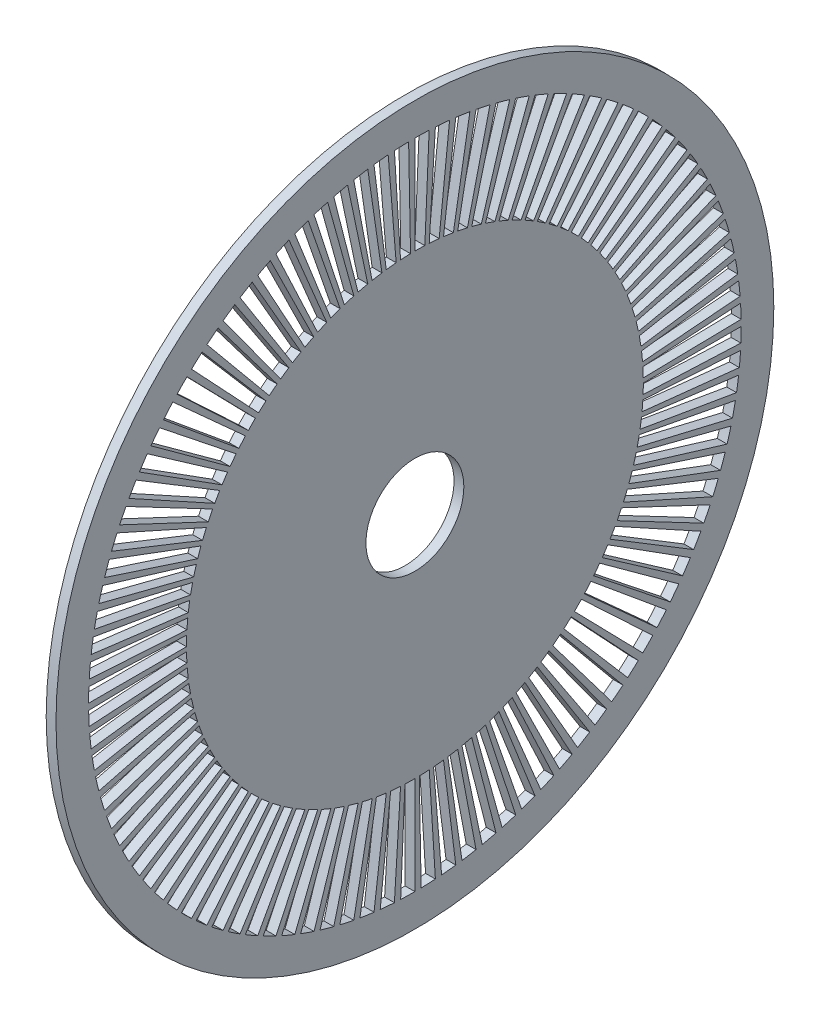
from build123d import *

# Parameters (mm, degrees)
ESQUISSE1_R        = 11
ESQUISSE1_R_2      = 1.5
BOSS_EXTRU_1_DEPTH = 0.3


with BuildPart() as part:
    # Esquisse1 → Boss.-Extru.1 (new body)
    with BuildSketch(Plane(origin=(0, 0, 0), x_dir=(0, 0, -1), z_dir=(1, 0, 0))):
        Circle(ESQUISSE1_R)
        Circle(ESQUISSE1_R_2, mode=Mode.SUBTRACT)
        with BuildLine():
            Line((0, 7), (0, 10))
            ThreePointArc((0, 10), (0.21814885, 9.997620271), (0.436193874, 9.990482216))
            Line((0.436193874, 9.990482216), (0.305335712, 6.993337551))
            ThreePointArc((0.305335712, 6.993337551), (0.152704195, 6.99833419), (0, 7))
        make_face(mode=Mode.SUBTRACT)
        with BuildLine():
            Line((0.743848499, 6.960365609), (1.062640713, 9.943379441))
            ThreePointArc((1.062640713, 9.943379441), (0.845474154, 9.964194571), (0.627905195, 9.980267284))
            Line((0.627905195, 9.980267284), (0.439533637, 6.986187099))
            ThreePointArc((0.439533637, 6.986187099), (0.591831908, 6.9749362), (0.743848499, 6.960365609))
        make_face(mode=Mode.SUBTRACT)
        with BuildLine():
            Line((1.179425657, 6.899924284), (1.684893796, 9.857034691))
            ThreePointArc((1.684893796, 9.857034691), (1.469462758, 9.891444748), (1.253332336, 9.921147013))
            Line((1.253332336, 9.921147013), (0.877332635, 6.944802909))
            ThreePointArc((0.877332635, 6.944802909), (1.028623931, 6.924011324), (1.179425657, 6.899924284))
        make_face(mode=Mode.SUBTRACT)
        with BuildLine():
            Line((1.61034816, 6.812252109), (2.300497372, 9.731788728))
            ThreePointArc((2.300497372, 9.731788728), (2.087652064, 9.779657911), (1.873813146, 9.822872507))
            Line((1.873813146, 9.822872507), (1.311669202, 6.876010755))
            ThreePointArc((1.311669202, 6.876010755), (1.461356444, 6.845760538), (1.61034816, 6.812252109))
        make_face(mode=Mode.SUBTRACT)
        with BuildLine():
            Line((2.034915355, 6.697695088), (2.907021936, 9.568135841))
            ThreePointArc((2.907021936, 9.568135841), (2.69760236, 9.629275233), (2.486898872, 9.685831611))
            Line((2.486898872, 9.685831611), (1.74082921, 6.780082128))
            ThreePointArc((1.74082921, 6.780082128), (1.888321652, 6.740492663), (2.034915355, 6.697695088))
        make_face(mode=Mode.SUBTRACT)
        with BuildLine():
            Line((2.451451669, 6.556705325), (3.502073813, 9.366721892))
            ThreePointArc((3.502073813, 9.366721892), (3.296906453, 9.440890204), (3.090169944, 9.510565163))
            Line((3.090169944, 9.510565163), (2.163118961, 6.657395614))
            ThreePointArc((2.163118961, 6.657395614), (2.307834517, 6.608623143), (2.451451669, 6.556705325))
        make_face(mode=Mode.SUBTRACT)
        with BuildLine():
            Line((2.858313223, 6.389839241), (4.083304604, 9.128341772))
            ThreePointArc((4.083304604, 9.128341772), (3.883199162, 9.215246295), (3.681245527, 9.297764859))
            Line((3.681245527, 9.297764859), (2.576871869, 6.508435401))
            ThreePointArc((2.576871869, 6.508435401), (2.718239413, 6.450672406), (2.858313223, 6.389839241))
        make_face(mode=Mode.SUBTRACT)
        with BuildLine():
            Line((3.25389432, 6.19775538), (4.648420457, 8.853936258))
            ThreePointArc((4.648420457, 8.853936258), (4.454166657, 8.953234018), (4.257792916, 9.048270525))
            Line((4.257792916, 9.048270525), (2.980455041, 6.333789367))
            ThreePointArc((2.980455041, 6.333789367), (3.11791666, 6.267263813), (3.25389432, 6.19775538))
        make_face(mode=Mode.SUBTRACT)
        with BuildLine():
            Line((3.636633783, 5.981211811), (5.195191119, 8.544588301))
            ThreePointArc((5.195191119, 8.544588301), (5.007555593, 8.655887418), (4.817536741, 8.7630668))
            Line((4.817536741, 8.7630668), (3.372275719, 6.13414676))
            ThreePointArc((3.372275719, 6.13414676), (3.505288915, 6.059121192), (3.636633783, 5.981211811))
        make_face(mode=Mode.SUBTRACT)
        with BuildLine():
            Line((4.005021114, 5.741063131), (5.721458734, 8.201518759))
            ThreePointArc((5.721458734, 8.201518759), (5.541181993, 8.324379984), (5.35826795, 8.443279255))
            Line((5.35826795, 8.443279255), (3.750787565, 5.910295479))
            ThreePointArc((3.750787565, 5.910295479), (3.878827395, 5.827065989), (4.005021114, 5.741063131))
        make_face(mode=Mode.SUBTRACT)
        with BuildLine():
            Line((4.357602456, 5.478257098), (6.225146366, 7.826081569))
            ThreePointArc((6.225146366, 7.826081569), (6.05293988, 7.960020025), (5.877852523, 8.090169944))
            Line((5.877852523, 8.090169944), (4.114496766, 5.663118961))
            ThreePointArc((4.114496766, 5.663118961), (4.237057916, 5.572014018), (4.357602456, 5.478257098))
        make_face(mode=Mode.SUBTRACT)
        with BuildLine():
            Line((4.692986333, 5.193830887), (6.70426619, 7.41975841))
            ThreePointArc((6.70426619, 7.41975841), (6.540809579, 7.564245504), (6.374239897, 7.705132428))
            Line((6.374239897, 7.705132428), (4.461967928, 5.393592699))
            ThreePointArc((4.461967928, 5.393592699), (4.578566705, 5.294971853), (4.692986333, 5.193830887))
        make_face(mode=Mode.SUBTRACT)
        with BuildLine():
            Line((5.009849136, 4.888906998), (7.156927337, 6.984152854))
            ThreePointArc((7.156927337, 6.984152854), (7.002865691, 7.138618362), (6.845471059, 7.289686274))
            Line((6.845471059, 7.289686274), (4.791829742, 5.102780392))
            ThreePointArc((4.791829742, 5.102780392), (4.902005983, 4.997032853), (5.009849136, 4.888906998))
        make_face(mode=Mode.SUBTRACT)
        with BuildLine():
            Line((5.306940353, 4.564688827), (7.581343362, 6.520984038))
            ThreePointArc((7.581343362, 6.520984038), (7.43728469, 6.684818355), (7.289686274, 6.845471059))
            Line((7.289686274, 6.845471059), (5.102780392, 4.791829742))
            ThreePointArc((5.102780392, 4.791829742), (5.206099283, 4.679372848), (5.306940353, 4.564688827))
        make_face(mode=Mode.SUBTRACT)
        with BuildLine():
            Line((5.583087502, 4.222455914), (7.975839288, 6.032079877))
            ThreePointArc((7.975839288, 6.032079877), (7.842352125, 6.204636423), (7.705132428, 6.374239897))
            Line((7.705132428, 6.374239897), (5.393592699, 4.461967928))
            ThreePointArc((5.393592699, 4.461967928), (5.489646488, 4.343245496), (5.583087502, 4.222455914))
        make_face(mode=Mode.SUBTRACT)
        with BuildLine():
            Line((5.837200754, 3.863558897), (8.338858221, 5.519369853))
            ThreePointArc((8.338858221, 5.519369853), (8.216469379, 5.699967626), (8.090169944, 5.877852523))
            Line((8.090169944, 5.877852523), (5.663118961, 4.114496766))
            ThreePointArc((5.663118961, 4.114496766), (5.751528566, 3.989977338), (5.837200754, 3.863558897))
        make_face(mode=Mode.SUBTRACT)
        with BuildLine():
            Line((6.068277243, 3.489414178), (8.668967489, 4.984877398))
            ThreePointArc((8.668967489, 4.984877398), (8.558159983, 5.172803661), (8.443279255, 5.35826795))
            Line((8.443279255, 5.35826795), (5.910295479, 3.750787565))
            ThreePointArc((5.910295479, 3.750787565), (5.990711988, 3.620962563), (6.068277243, 3.489414178))
        make_face(mode=Mode.SUBTRACT)
        with BuildLine():
            Line((6.275405013, 3.101498336), (8.964864304, 4.430711908))
            ThreePointArc((8.964864304, 4.430711908), (8.866075438, 4.625225003), (8.7630668, 4.817536741))
            Line((8.7630668, 4.817536741), (6.13414676, 3.372275719))
            ThreePointArc((6.13414676, 3.372275719), (6.206252807, 3.237657502), (6.275405013, 3.101498336))
        make_face(mode=Mode.SUBTRACT)
        with BuildLine():
            Line((6.457766626, 2.701342296), (9.225380895, 3.859060423))
            ThreePointArc((9.225380895, 3.859060423), (9.139000544, 4.059392695), (9.048270525, 4.257792916))
            Line((9.048270525, 4.257792916), (6.333789367, 2.980455041))
            ThreePointArc((6.333789367, 2.980455041), (6.397300381, 2.841574886), (6.457766626, 2.701342296))
        make_face(mode=Mode.SUBTRACT)
        with BuildLine():
            Line((6.614642385, 2.290525293), (9.449489122, 3.27217899))
            ThreePointArc((9.449489122, 3.27217899), (9.375858191, 3.477539819), (9.297764859, 3.681245527))
            Line((9.297764859, 3.681245527), (6.508435401, 2.576871869))
            ThreePointArc((6.508435401, 2.576871869), (6.563100733, 2.434277873), (6.614642385, 2.290525293))
        make_face(mode=Mode.SUBTRACT)
        with BuildLine():
            Line((6.745413172, 1.870668633), (9.636304532, 2.672383761))
            ThreePointArc((9.636304532, 2.672383761), (9.575713608, 2.881962681), (9.510565163, 3.090169944))
            Line((9.510565163, 3.090169944), (6.657395614, 2.163118961))
            ThreePointArc((6.657395614, 2.163118961), (6.702999526, 2.017373877), (6.745413172, 1.870668633))
        make_face(mode=Mode.SUBTRACT)
        with BuildLine():
            Line((6.849562896, 1.443429298), (9.785089851, 2.062041854))
            ThreePointArc((9.785089851, 2.062041854), (9.737778059, 2.275011754), (9.685831611, 2.486898872))
            Line((9.685831611, 2.486898872), (6.780082128, 1.74082921))
            ThreePointArc((6.780082128, 1.74082921), (6.816444641, 1.592508228), (6.849562896, 1.443429298))
        make_face(mode=Mode.SUBTRACT)
        with BuildLine():
            Line((6.926680523, 1.010493407), (9.895257891, 1.44356201))
            ThreePointArc((9.895257891, 1.44356201), (9.861411948, 1.659082395), (9.822872507, 1.873813146))
            Line((9.822872507, 1.873813146), (6.876010755, 1.311669202))
            ThreePointArc((6.876010755, 1.311669202), (6.902988364, 1.161357676), (6.926680523, 1.010493407))
        make_face(mode=Mode.SUBTRACT)
        with BuildLine():
            Line((6.976461708, 0.57356956), (9.966373868, 0.819385086))
            ThreePointArc((9.966373868, 0.819385086), (9.94612735, 1.036605395), (9.921147013, 1.253332336))
            Line((9.921147013, 1.253332336), (6.944802909, 0.877332635))
            ThreePointArc((6.944802909, 0.877332635), (6.962289145, 0.725623776), (6.976461708, 0.57356956))
        make_face(mode=Mode.SUBTRACT)
        with BuildLine():
            Line((6.998709985, 0.134382097), (9.998157121, 0.191974424))
            ThreePointArc((9.998157121, 0.191974424), (9.991589931, 0.410037387), (9.980267284, 0.627905195))
            Line((9.980267284, 0.627905195), (6.986187099, 0.439533637))
            ThreePointArc((6.986187099, 0.439533637), (6.994112951, 0.287026171), (6.998709985, 0.134382097))
        make_face(mode=Mode.SUBTRACT)
        with BuildLine():
            Line((6.993337551, -0.305335712), (9.990482216, -0.436193874))
            ThreePointArc((9.990482216, -0.436193874), (9.997620271, -0.21814885), (10, 0))
            Line((10, 0), (7, 0))
            ThreePointArc((7, 0), (6.99833419, -0.152704195), (6.993337551, -0.305335712))
        make_face(mode=Mode.SUBTRACT)
        with BuildLine():
            Line((6.960365609, -0.743848499), (9.943379441, -1.062640713))
            ThreePointArc((9.943379441, -1.062640713), (9.964194571, -0.845474154), (9.980267284, -0.627905195))
            Line((9.980267284, -0.627905195), (6.986187099, -0.439533637))
            ThreePointArc((6.986187099, -0.439533637), (6.9749362, -0.591831908), (6.960365609, -0.743848499))
        make_face(mode=Mode.SUBTRACT)
        with BuildLine():
            Line((6.899924284, -1.179425657), (9.857034691, -1.684893796))
            ThreePointArc((9.857034691, -1.684893796), (9.891444748, -1.469462758), (9.921147013, -1.253332336))
            Line((9.921147013, -1.253332336), (6.944802909, -0.877332635))
            ThreePointArc((6.944802909, -0.877332635), (6.924011324, -1.028623931), (6.899924284, -1.179425657))
        make_face(mode=Mode.SUBTRACT)
        with BuildLine():
            Line((6.812252109, -1.61034816), (9.731788728, -2.300497372))
            ThreePointArc((9.731788728, -2.300497372), (9.779657911, -2.087652064), (9.822872507, -1.873813146))
            Line((9.822872507, -1.873813146), (6.876010755, -1.311669202))
            ThreePointArc((6.876010755, -1.311669202), (6.845760538, -1.461356444), (6.812252109, -1.61034816))
        make_face(mode=Mode.SUBTRACT)
        with BuildLine():
            Line((6.697695088, -2.034915355), (9.568135841, -2.907021936))
            ThreePointArc((9.568135841, -2.907021936), (9.629275233, -2.69760236), (9.685831611, -2.486898872))
            Line((9.685831611, -2.486898872), (6.780082128, -1.74082921))
            ThreePointArc((6.780082128, -1.74082921), (6.740492663, -1.888321652), (6.697695088, -2.034915355))
        make_face(mode=Mode.SUBTRACT)
        with BuildLine():
            Line((6.556705325, -2.451451669), (9.366721892, -3.502073813))
            ThreePointArc((9.366721892, -3.502073813), (9.440890204, -3.296906453), (9.510565163, -3.090169944))
            Line((9.510565163, -3.090169944), (6.657395614, -2.163118961))
            ThreePointArc((6.657395614, -2.163118961), (6.608623143, -2.307834517), (6.556705325, -2.451451669))
        make_face(mode=Mode.SUBTRACT)
        with BuildLine():
            Line((6.389839241, -2.858313223), (9.128341772, -4.083304604))
            ThreePointArc((9.128341772, -4.083304604), (9.215246295, -3.883199162), (9.297764859, -3.681245527))
            Line((9.297764859, -3.681245527), (6.508435401, -2.576871869))
            ThreePointArc((6.508435401, -2.576871869), (6.450672406, -2.718239413), (6.389839241, -2.858313223))
        make_face(mode=Mode.SUBTRACT)
        with BuildLine():
            Line((6.19775538, -3.25389432), (8.853936258, -4.648420457))
            ThreePointArc((8.853936258, -4.648420457), (8.953234018, -4.454166657), (9.048270525, -4.257792916))
            Line((9.048270525, -4.257792916), (6.333789367, -2.980455041))
            ThreePointArc((6.333789367, -2.980455041), (6.267263813, -3.11791666), (6.19775538, -3.25389432))
        make_face(mode=Mode.SUBTRACT)
        with BuildLine():
            Line((5.981211811, -3.636633783), (8.544588301, -5.195191119))
            ThreePointArc((8.544588301, -5.195191119), (8.655887418, -5.007555593), (8.7630668, -4.817536741))
            Line((8.7630668, -4.817536741), (6.13414676, -3.372275719))
            ThreePointArc((6.13414676, -3.372275719), (6.059121192, -3.505288915), (5.981211811, -3.636633783))
        make_face(mode=Mode.SUBTRACT)
        with BuildLine():
            Line((5.741063131, -4.005021114), (8.201518759, -5.721458734))
            ThreePointArc((8.201518759, -5.721458734), (8.324379984, -5.541181993), (8.443279255, -5.35826795))
            Line((8.443279255, -5.35826795), (5.910295479, -3.750787565))
            ThreePointArc((5.910295479, -3.750787565), (5.827065989, -3.878827395), (5.741063131, -4.005021114))
        make_face(mode=Mode.SUBTRACT)
        with BuildLine():
            Line((5.478257098, -4.357602456), (7.826081569, -6.225146366))
            ThreePointArc((7.826081569, -6.225146366), (7.960020025, -6.05293988), (8.090169944, -5.877852523))
            Line((8.090169944, -5.877852523), (5.663118961, -4.114496766))
            ThreePointArc((5.663118961, -4.114496766), (5.572014018, -4.237057916), (5.478257098, -4.357602456))
        make_face(mode=Mode.SUBTRACT)
        with BuildLine():
            Line((5.193830887, -4.692986333), (7.41975841, -6.70426619))
            ThreePointArc((7.41975841, -6.70426619), (7.564245504, -6.540809579), (7.705132428, -6.374239897))
            Line((7.705132428, -6.374239897), (5.393592699, -4.461967928))
            ThreePointArc((5.393592699, -4.461967928), (5.294971853, -4.578566705), (5.193830887, -4.692986333))
        make_face(mode=Mode.SUBTRACT)
        with BuildLine():
            Line((4.888906998, -5.009849136), (6.984152854, -7.156927337))
            ThreePointArc((6.984152854, -7.156927337), (7.138618362, -7.002865691), (7.289686274, -6.845471059))
            Line((7.289686274, -6.845471059), (5.102780392, -4.791829742))
            ThreePointArc((5.102780392, -4.791829742), (4.997032853, -4.902005983), (4.888906998, -5.009849136))
        make_face(mode=Mode.SUBTRACT)
        with BuildLine():
            Line((4.564688827, -5.306940353), (6.520984038, -7.581343362))
            ThreePointArc((6.520984038, -7.581343362), (6.684818355, -7.43728469), (6.845471059, -7.289686274))
            Line((6.845471059, -7.289686274), (4.791829742, -5.102780392))
            ThreePointArc((4.791829742, -5.102780392), (4.679372848, -5.206099283), (4.564688827, -5.306940353))
        make_face(mode=Mode.SUBTRACT)
        with BuildLine():
            Line((4.222455914, -5.583087502), (6.032079877, -7.975839288))
            ThreePointArc((6.032079877, -7.975839288), (6.204636423, -7.842352125), (6.374239897, -7.705132428))
            Line((6.374239897, -7.705132428), (4.461967928, -5.393592699))
            ThreePointArc((4.461967928, -5.393592699), (4.343245496, -5.489646488), (4.222455914, -5.583087502))
        make_face(mode=Mode.SUBTRACT)
        with BuildLine():
            Line((3.863558897, -5.837200754), (5.519369853, -8.338858221))
            ThreePointArc((5.519369853, -8.338858221), (5.699967626, -8.216469379), (5.877852523, -8.090169944))
            Line((5.877852523, -8.090169944), (4.114496766, -5.663118961))
            ThreePointArc((4.114496766, -5.663118961), (3.989977338, -5.751528566), (3.863558897, -5.837200754))
        make_face(mode=Mode.SUBTRACT)
        with BuildLine():
            Line((3.489414178, -6.068277243), (4.984877398, -8.668967489))
            ThreePointArc((4.984877398, -8.668967489), (5.172803661, -8.558159983), (5.35826795, -8.443279255))
            Line((5.35826795, -8.443279255), (3.750787565, -5.910295479))
            ThreePointArc((3.750787565, -5.910295479), (3.620962563, -5.990711988), (3.489414178, -6.068277243))
        make_face(mode=Mode.SUBTRACT)
        with BuildLine():
            Line((3.101498336, -6.275405013), (4.430711908, -8.964864304))
            ThreePointArc((4.430711908, -8.964864304), (4.625225003, -8.866075438), (4.817536741, -8.7630668))
            Line((4.817536741, -8.7630668), (3.372275719, -6.13414676))
            ThreePointArc((3.372275719, -6.13414676), (3.237657502, -6.206252807), (3.101498336, -6.275405013))
        make_face(mode=Mode.SUBTRACT)
        with BuildLine():
            Line((2.701342296, -6.457766626), (3.859060423, -9.225380895))
            ThreePointArc((3.859060423, -9.225380895), (4.059392695, -9.139000544), (4.257792916, -9.048270525))
            Line((4.257792916, -9.048270525), (2.980455041, -6.333789367))
            ThreePointArc((2.980455041, -6.333789367), (2.841574886, -6.397300381), (2.701342296, -6.457766626))
        make_face(mode=Mode.SUBTRACT)
        with BuildLine():
            Line((2.290525293, -6.614642385), (3.27217899, -9.449489122))
            ThreePointArc((3.27217899, -9.449489122), (3.477539819, -9.375858191), (3.681245527, -9.297764859))
            Line((3.681245527, -9.297764859), (2.576871869, -6.508435401))
            ThreePointArc((2.576871869, -6.508435401), (2.434277873, -6.563100733), (2.290525293, -6.614642385))
        make_face(mode=Mode.SUBTRACT)
        with BuildLine():
            Line((1.870668633, -6.745413172), (2.672383761, -9.636304532))
            ThreePointArc((2.672383761, -9.636304532), (2.881962681, -9.575713608), (3.090169944, -9.510565163))
            Line((3.090169944, -9.510565163), (2.163118961, -6.657395614))
            ThreePointArc((2.163118961, -6.657395614), (2.017373877, -6.702999526), (1.870668633, -6.745413172))
        make_face(mode=Mode.SUBTRACT)
        with BuildLine():
            Line((1.443429298, -6.849562896), (2.062041854, -9.785089851))
            ThreePointArc((2.062041854, -9.785089851), (2.275011754, -9.737778059), (2.486898872, -9.685831611))
            Line((2.486898872, -9.685831611), (1.74082921, -6.780082128))
            ThreePointArc((1.74082921, -6.780082128), (1.592508228, -6.816444641), (1.443429298, -6.849562896))
        make_face(mode=Mode.SUBTRACT)
        with BuildLine():
            Line((1.010493407, -6.926680523), (1.44356201, -9.895257891))
            ThreePointArc((1.44356201, -9.895257891), (1.659082395, -9.861411948), (1.873813146, -9.822872507))
            Line((1.873813146, -9.822872507), (1.311669202, -6.876010755))
            ThreePointArc((1.311669202, -6.876010755), (1.161357676, -6.902988364), (1.010493407, -6.926680523))
        make_face(mode=Mode.SUBTRACT)
        with BuildLine():
            Line((0.57356956, -6.976461708), (0.819385086, -9.966373868))
            ThreePointArc((0.819385086, -9.966373868), (1.036605395, -9.94612735), (1.253332336, -9.921147013))
            Line((1.253332336, -9.921147013), (0.877332635, -6.944802909))
            ThreePointArc((0.877332635, -6.944802909), (0.725623776, -6.962289145), (0.57356956, -6.976461708))
        make_face(mode=Mode.SUBTRACT)
        with BuildLine():
            Line((0.134382097, -6.998709985), (0.191974424, -9.998157121))
            ThreePointArc((0.191974424, -9.998157121), (0.410037387, -9.991589931), (0.627905195, -9.980267284))
            Line((0.627905195, -9.980267284), (0.439533637, -6.986187099))
            ThreePointArc((0.439533637, -6.986187099), (0.287026171, -6.994112951), (0.134382097, -6.998709985))
        make_face(mode=Mode.SUBTRACT)
        with BuildLine():
            Line((-0.305335712, -6.993337551), (-0.436193874, -9.990482216))
            ThreePointArc((-0.436193874, -9.990482216), (-0.21814885, -9.997620271), (0, -10))
            Line((0, -10), (0, -7))
            ThreePointArc((0, -7), (-0.152704195, -6.99833419), (-0.305335712, -6.993337551))
        make_face(mode=Mode.SUBTRACT)
        with BuildLine():
            Line((-0.743848499, -6.960365609), (-1.062640713, -9.943379441))
            ThreePointArc((-1.062640713, -9.943379441), (-0.845474154, -9.964194571), (-0.627905195, -9.980267284))
            Line((-0.627905195, -9.980267284), (-0.439533637, -6.986187099))
            ThreePointArc((-0.439533637, -6.986187099), (-0.591831908, -6.9749362), (-0.743848499, -6.960365609))
        make_face(mode=Mode.SUBTRACT)
        with BuildLine():
            Line((-1.179425657, -6.899924284), (-1.684893796, -9.857034691))
            ThreePointArc((-1.684893796, -9.857034691), (-1.469462758, -9.891444748), (-1.253332336, -9.921147013))
            Line((-1.253332336, -9.921147013), (-0.877332635, -6.944802909))
            ThreePointArc((-0.877332635, -6.944802909), (-1.028623931, -6.924011324), (-1.179425657, -6.899924284))
        make_face(mode=Mode.SUBTRACT)
        with BuildLine():
            Line((-1.61034816, -6.812252109), (-2.300497372, -9.731788728))
            ThreePointArc((-2.300497372, -9.731788728), (-2.087652064, -9.779657911), (-1.873813146, -9.822872507))
            Line((-1.873813146, -9.822872507), (-1.311669202, -6.876010755))
            ThreePointArc((-1.311669202, -6.876010755), (-1.461356444, -6.845760538), (-1.61034816, -6.812252109))
        make_face(mode=Mode.SUBTRACT)
        with BuildLine():
            Line((-2.034915355, -6.697695088), (-2.907021936, -9.568135841))
            ThreePointArc((-2.907021936, -9.568135841), (-2.69760236, -9.629275233), (-2.486898872, -9.685831611))
            Line((-2.486898872, -9.685831611), (-1.74082921, -6.780082128))
            ThreePointArc((-1.74082921, -6.780082128), (-1.888321652, -6.740492663), (-2.034915355, -6.697695088))
        make_face(mode=Mode.SUBTRACT)
        with BuildLine():
            Line((-2.451451669, -6.556705325), (-3.502073813, -9.366721892))
            ThreePointArc((-3.502073813, -9.366721892), (-3.296906453, -9.440890204), (-3.090169944, -9.510565163))
            Line((-3.090169944, -9.510565163), (-2.163118961, -6.657395614))
            ThreePointArc((-2.163118961, -6.657395614), (-2.307834517, -6.608623143), (-2.451451669, -6.556705325))
        make_face(mode=Mode.SUBTRACT)
        with BuildLine():
            Line((-2.858313223, -6.389839241), (-4.083304604, -9.128341772))
            ThreePointArc((-4.083304604, -9.128341772), (-3.883199162, -9.215246295), (-3.681245527, -9.297764859))
            Line((-3.681245527, -9.297764859), (-2.576871869, -6.508435401))
            ThreePointArc((-2.576871869, -6.508435401), (-2.718239413, -6.450672406), (-2.858313223, -6.389839241))
        make_face(mode=Mode.SUBTRACT)
        with BuildLine():
            Line((-3.25389432, -6.19775538), (-4.648420457, -8.853936258))
            ThreePointArc((-4.648420457, -8.853936258), (-4.454166657, -8.953234018), (-4.257792916, -9.048270525))
            Line((-4.257792916, -9.048270525), (-2.980455041, -6.333789367))
            ThreePointArc((-2.980455041, -6.333789367), (-3.11791666, -6.267263813), (-3.25389432, -6.19775538))
        make_face(mode=Mode.SUBTRACT)
        with BuildLine():
            Line((-3.636633783, -5.981211811), (-5.195191119, -8.544588301))
            ThreePointArc((-5.195191119, -8.544588301), (-5.007555593, -8.655887418), (-4.817536741, -8.7630668))
            Line((-4.817536741, -8.7630668), (-3.372275719, -6.13414676))
            ThreePointArc((-3.372275719, -6.13414676), (-3.505288915, -6.059121192), (-3.636633783, -5.981211811))
        make_face(mode=Mode.SUBTRACT)
        with BuildLine():
            Line((-4.005021114, -5.741063131), (-5.721458734, -8.201518759))
            ThreePointArc((-5.721458734, -8.201518759), (-5.541181993, -8.324379984), (-5.35826795, -8.443279255))
            Line((-5.35826795, -8.443279255), (-3.750787565, -5.910295479))
            ThreePointArc((-3.750787565, -5.910295479), (-3.878827395, -5.827065989), (-4.005021114, -5.741063131))
        make_face(mode=Mode.SUBTRACT)
        with BuildLine():
            Line((-4.357602456, -5.478257098), (-6.225146366, -7.826081569))
            ThreePointArc((-6.225146366, -7.826081569), (-6.05293988, -7.960020025), (-5.877852523, -8.090169944))
            Line((-5.877852523, -8.090169944), (-4.114496766, -5.663118961))
            ThreePointArc((-4.114496766, -5.663118961), (-4.237057916, -5.572014018), (-4.357602456, -5.478257098))
        make_face(mode=Mode.SUBTRACT)
        with BuildLine():
            Line((-4.692986333, -5.193830887), (-6.70426619, -7.41975841))
            ThreePointArc((-6.70426619, -7.41975841), (-6.540809579, -7.564245504), (-6.374239897, -7.705132428))
            Line((-6.374239897, -7.705132428), (-4.461967928, -5.393592699))
            ThreePointArc((-4.461967928, -5.393592699), (-4.578566705, -5.294971853), (-4.692986333, -5.193830887))
        make_face(mode=Mode.SUBTRACT)
        with BuildLine():
            Line((-5.009849136, -4.888906998), (-7.156927337, -6.984152854))
            ThreePointArc((-7.156927337, -6.984152854), (-7.002865691, -7.138618362), (-6.845471059, -7.289686274))
            Line((-6.845471059, -7.289686274), (-4.791829742, -5.102780392))
            ThreePointArc((-4.791829742, -5.102780392), (-4.902005983, -4.997032853), (-5.009849136, -4.888906998))
        make_face(mode=Mode.SUBTRACT)
        with BuildLine():
            Line((-5.306940353, -4.564688827), (-7.581343362, -6.520984038))
            ThreePointArc((-7.581343362, -6.520984038), (-7.43728469, -6.684818355), (-7.289686274, -6.845471059))
            Line((-7.289686274, -6.845471059), (-5.102780392, -4.791829742))
            ThreePointArc((-5.102780392, -4.791829742), (-5.206099283, -4.679372848), (-5.306940353, -4.564688827))
        make_face(mode=Mode.SUBTRACT)
        with BuildLine():
            Line((-5.583087502, -4.222455914), (-7.975839288, -6.032079877))
            ThreePointArc((-7.975839288, -6.032079877), (-7.842352125, -6.204636423), (-7.705132428, -6.374239897))
            Line((-7.705132428, -6.374239897), (-5.393592699, -4.461967928))
            ThreePointArc((-5.393592699, -4.461967928), (-5.489646488, -4.343245496), (-5.583087502, -4.222455914))
        make_face(mode=Mode.SUBTRACT)
        with BuildLine():
            Line((-5.837200754, -3.863558897), (-8.338858221, -5.519369853))
            ThreePointArc((-8.338858221, -5.519369853), (-8.216469379, -5.699967626), (-8.090169944, -5.877852523))
            Line((-8.090169944, -5.877852523), (-5.663118961, -4.114496766))
            ThreePointArc((-5.663118961, -4.114496766), (-5.751528566, -3.989977338), (-5.837200754, -3.863558897))
        make_face(mode=Mode.SUBTRACT)
        with BuildLine():
            Line((-6.068277243, -3.489414178), (-8.668967489, -4.984877398))
            ThreePointArc((-8.668967489, -4.984877398), (-8.558159983, -5.172803661), (-8.443279255, -5.35826795))
            Line((-8.443279255, -5.35826795), (-5.910295479, -3.750787565))
            ThreePointArc((-5.910295479, -3.750787565), (-5.990711988, -3.620962563), (-6.068277243, -3.489414178))
        make_face(mode=Mode.SUBTRACT)
        with BuildLine():
            Line((-6.275405013, -3.101498336), (-8.964864304, -4.430711908))
            ThreePointArc((-8.964864304, -4.430711908), (-8.866075438, -4.625225003), (-8.7630668, -4.817536741))
            Line((-8.7630668, -4.817536741), (-6.13414676, -3.372275719))
            ThreePointArc((-6.13414676, -3.372275719), (-6.206252807, -3.237657502), (-6.275405013, -3.101498336))
        make_face(mode=Mode.SUBTRACT)
        with BuildLine():
            Line((-6.457766626, -2.701342296), (-9.225380895, -3.859060423))
            ThreePointArc((-9.225380895, -3.859060423), (-9.139000544, -4.059392695), (-9.048270525, -4.257792916))
            Line((-9.048270525, -4.257792916), (-6.333789367, -2.980455041))
            ThreePointArc((-6.333789367, -2.980455041), (-6.397300381, -2.841574886), (-6.457766626, -2.701342296))
        make_face(mode=Mode.SUBTRACT)
        with BuildLine():
            Line((-6.614642385, -2.290525293), (-9.449489122, -3.27217899))
            ThreePointArc((-9.449489122, -3.27217899), (-9.375858191, -3.477539819), (-9.297764859, -3.681245527))
            Line((-9.297764859, -3.681245527), (-6.508435401, -2.576871869))
            ThreePointArc((-6.508435401, -2.576871869), (-6.563100733, -2.434277873), (-6.614642385, -2.290525293))
        make_face(mode=Mode.SUBTRACT)
        with BuildLine():
            Line((-6.745413172, -1.870668633), (-9.636304532, -2.672383761))
            ThreePointArc((-9.636304532, -2.672383761), (-9.575713608, -2.881962681), (-9.510565163, -3.090169944))
            Line((-9.510565163, -3.090169944), (-6.657395614, -2.163118961))
            ThreePointArc((-6.657395614, -2.163118961), (-6.702999526, -2.017373877), (-6.745413172, -1.870668633))
        make_face(mode=Mode.SUBTRACT)
        with BuildLine():
            Line((-6.849562896, -1.443429298), (-9.785089851, -2.062041854))
            ThreePointArc((-9.785089851, -2.062041854), (-9.737778059, -2.275011754), (-9.685831611, -2.486898872))
            Line((-9.685831611, -2.486898872), (-6.780082128, -1.74082921))
            ThreePointArc((-6.780082128, -1.74082921), (-6.816444641, -1.592508228), (-6.849562896, -1.443429298))
        make_face(mode=Mode.SUBTRACT)
        with BuildLine():
            Line((-6.926680523, -1.010493407), (-9.895257891, -1.44356201))
            ThreePointArc((-9.895257891, -1.44356201), (-9.861411948, -1.659082395), (-9.822872507, -1.873813146))
            Line((-9.822872507, -1.873813146), (-6.876010755, -1.311669202))
            ThreePointArc((-6.876010755, -1.311669202), (-6.902988364, -1.161357676), (-6.926680523, -1.010493407))
        make_face(mode=Mode.SUBTRACT)
        with BuildLine():
            Line((-6.976461708, -0.57356956), (-9.966373868, -0.819385086))
            ThreePointArc((-9.966373868, -0.819385086), (-9.94612735, -1.036605395), (-9.921147013, -1.253332336))
            Line((-9.921147013, -1.253332336), (-6.944802909, -0.877332635))
            ThreePointArc((-6.944802909, -0.877332635), (-6.962289145, -0.725623776), (-6.976461708, -0.57356956))
        make_face(mode=Mode.SUBTRACT)
        with BuildLine():
            Line((-6.998709985, -0.134382097), (-9.998157121, -0.191974424))
            ThreePointArc((-9.998157121, -0.191974424), (-9.991589931, -0.410037387), (-9.980267284, -0.627905195))
            Line((-9.980267284, -0.627905195), (-6.986187099, -0.439533637))
            ThreePointArc((-6.986187099, -0.439533637), (-6.994112951, -0.287026171), (-6.998709985, -0.134382097))
        make_face(mode=Mode.SUBTRACT)
        with BuildLine():
            Line((-6.993337551, 0.305335712), (-9.990482216, 0.436193874))
            ThreePointArc((-9.990482216, 0.436193874), (-9.997620271, 0.21814885), (-10, 0))
            Line((-10, 0), (-7, 0))
            ThreePointArc((-7, 0), (-6.99833419, 0.152704195), (-6.993337551, 0.305335712))
        make_face(mode=Mode.SUBTRACT)
        with BuildLine():
            Line((-6.960365609, 0.743848499), (-9.943379441, 1.062640713))
            ThreePointArc((-9.943379441, 1.062640713), (-9.964194571, 0.845474154), (-9.980267284, 0.627905195))
            Line((-9.980267284, 0.627905195), (-6.986187099, 0.439533637))
            ThreePointArc((-6.986187099, 0.439533637), (-6.9749362, 0.591831908), (-6.960365609, 0.743848499))
        make_face(mode=Mode.SUBTRACT)
        with BuildLine():
            Line((-6.899924284, 1.179425657), (-9.857034691, 1.684893796))
            ThreePointArc((-9.857034691, 1.684893796), (-9.891444748, 1.469462758), (-9.921147013, 1.253332336))
            Line((-9.921147013, 1.253332336), (-6.944802909, 0.877332635))
            ThreePointArc((-6.944802909, 0.877332635), (-6.924011324, 1.028623931), (-6.899924284, 1.179425657))
        make_face(mode=Mode.SUBTRACT)
        with BuildLine():
            Line((-6.812252109, 1.61034816), (-9.731788728, 2.300497372))
            ThreePointArc((-9.731788728, 2.300497372), (-9.779657911, 2.087652064), (-9.822872507, 1.873813146))
            Line((-9.822872507, 1.873813146), (-6.876010755, 1.311669202))
            ThreePointArc((-6.876010755, 1.311669202), (-6.845760538, 1.461356444), (-6.812252109, 1.61034816))
        make_face(mode=Mode.SUBTRACT)
        with BuildLine():
            Line((-6.697695088, 2.034915355), (-9.568135841, 2.907021936))
            ThreePointArc((-9.568135841, 2.907021936), (-9.629275233, 2.69760236), (-9.685831611, 2.486898872))
            Line((-9.685831611, 2.486898872), (-6.780082128, 1.74082921))
            ThreePointArc((-6.780082128, 1.74082921), (-6.740492663, 1.888321652), (-6.697695088, 2.034915355))
        make_face(mode=Mode.SUBTRACT)
        with BuildLine():
            Line((-6.556705325, 2.451451669), (-9.366721892, 3.502073813))
            ThreePointArc((-9.366721892, 3.502073813), (-9.440890204, 3.296906453), (-9.510565163, 3.090169944))
            Line((-9.510565163, 3.090169944), (-6.657395614, 2.163118961))
            ThreePointArc((-6.657395614, 2.163118961), (-6.608623143, 2.307834517), (-6.556705325, 2.451451669))
        make_face(mode=Mode.SUBTRACT)
        with BuildLine():
            Line((-6.389839241, 2.858313223), (-9.128341772, 4.083304604))
            ThreePointArc((-9.128341772, 4.083304604), (-9.215246295, 3.883199162), (-9.297764859, 3.681245527))
            Line((-9.297764859, 3.681245527), (-6.508435401, 2.576871869))
            ThreePointArc((-6.508435401, 2.576871869), (-6.450672406, 2.718239413), (-6.389839241, 2.858313223))
        make_face(mode=Mode.SUBTRACT)
        with BuildLine():
            Line((-6.19775538, 3.25389432), (-8.853936258, 4.648420457))
            ThreePointArc((-8.853936258, 4.648420457), (-8.953234018, 4.454166657), (-9.048270525, 4.257792916))
            Line((-9.048270525, 4.257792916), (-6.333789367, 2.980455041))
            ThreePointArc((-6.333789367, 2.980455041), (-6.267263813, 3.11791666), (-6.19775538, 3.25389432))
        make_face(mode=Mode.SUBTRACT)
        with BuildLine():
            Line((-5.981211811, 3.636633783), (-8.544588301, 5.195191119))
            ThreePointArc((-8.544588301, 5.195191119), (-8.655887418, 5.007555593), (-8.7630668, 4.817536741))
            Line((-8.7630668, 4.817536741), (-6.13414676, 3.372275719))
            ThreePointArc((-6.13414676, 3.372275719), (-6.059121192, 3.505288915), (-5.981211811, 3.636633783))
        make_face(mode=Mode.SUBTRACT)
        with BuildLine():
            Line((-5.741063131, 4.005021114), (-8.201518759, 5.721458734))
            ThreePointArc((-8.201518759, 5.721458734), (-8.324379984, 5.541181993), (-8.443279255, 5.35826795))
            Line((-8.443279255, 5.35826795), (-5.910295479, 3.750787565))
            ThreePointArc((-5.910295479, 3.750787565), (-5.827065989, 3.878827395), (-5.741063131, 4.005021114))
        make_face(mode=Mode.SUBTRACT)
        with BuildLine():
            Line((-5.478257098, 4.357602456), (-7.826081569, 6.225146366))
            ThreePointArc((-7.826081569, 6.225146366), (-7.960020025, 6.05293988), (-8.090169944, 5.877852523))
            Line((-8.090169944, 5.877852523), (-5.663118961, 4.114496766))
            ThreePointArc((-5.663118961, 4.114496766), (-5.572014018, 4.237057916), (-5.478257098, 4.357602456))
        make_face(mode=Mode.SUBTRACT)
        with BuildLine():
            Line((-5.193830887, 4.692986333), (-7.41975841, 6.70426619))
            ThreePointArc((-7.41975841, 6.70426619), (-7.564245504, 6.540809579), (-7.705132428, 6.374239897))
            Line((-7.705132428, 6.374239897), (-5.393592699, 4.461967928))
            ThreePointArc((-5.393592699, 4.461967928), (-5.294971853, 4.578566705), (-5.193830887, 4.692986333))
        make_face(mode=Mode.SUBTRACT)
        with BuildLine():
            Line((-4.888906998, 5.009849136), (-6.984152854, 7.156927337))
            ThreePointArc((-6.984152854, 7.156927337), (-7.138618362, 7.002865691), (-7.289686274, 6.845471059))
            Line((-7.289686274, 6.845471059), (-5.102780392, 4.791829742))
            ThreePointArc((-5.102780392, 4.791829742), (-4.997032853, 4.902005983), (-4.888906998, 5.009849136))
        make_face(mode=Mode.SUBTRACT)
        with BuildLine():
            Line((-4.564688827, 5.306940353), (-6.520984038, 7.581343362))
            ThreePointArc((-6.520984038, 7.581343362), (-6.684818355, 7.43728469), (-6.845471059, 7.289686274))
            Line((-6.845471059, 7.289686274), (-4.791829742, 5.102780392))
            ThreePointArc((-4.791829742, 5.102780392), (-4.679372848, 5.206099283), (-4.564688827, 5.306940353))
        make_face(mode=Mode.SUBTRACT)
        with BuildLine():
            Line((-4.222455914, 5.583087502), (-6.032079877, 7.975839288))
            ThreePointArc((-6.032079877, 7.975839288), (-6.204636423, 7.842352125), (-6.374239897, 7.705132428))
            Line((-6.374239897, 7.705132428), (-4.461967928, 5.393592699))
            ThreePointArc((-4.461967928, 5.393592699), (-4.343245496, 5.489646488), (-4.222455914, 5.583087502))
        make_face(mode=Mode.SUBTRACT)
        with BuildLine():
            Line((-3.863558897, 5.837200754), (-5.519369853, 8.338858221))
            ThreePointArc((-5.519369853, 8.338858221), (-5.699967626, 8.216469379), (-5.877852523, 8.090169944))
            Line((-5.877852523, 8.090169944), (-4.114496766, 5.663118961))
            ThreePointArc((-4.114496766, 5.663118961), (-3.989977338, 5.751528566), (-3.863558897, 5.837200754))
        make_face(mode=Mode.SUBTRACT)
        with BuildLine():
            Line((-3.489414178, 6.068277243), (-4.984877398, 8.668967489))
            ThreePointArc((-4.984877398, 8.668967489), (-5.172803661, 8.558159983), (-5.35826795, 8.443279255))
            Line((-5.35826795, 8.443279255), (-3.750787565, 5.910295479))
            ThreePointArc((-3.750787565, 5.910295479), (-3.620962563, 5.990711988), (-3.489414178, 6.068277243))
        make_face(mode=Mode.SUBTRACT)
        with BuildLine():
            Line((-3.101498336, 6.275405013), (-4.430711908, 8.964864304))
            ThreePointArc((-4.430711908, 8.964864304), (-4.625225003, 8.866075438), (-4.817536741, 8.7630668))
            Line((-4.817536741, 8.7630668), (-3.372275719, 6.13414676))
            ThreePointArc((-3.372275719, 6.13414676), (-3.237657502, 6.206252807), (-3.101498336, 6.275405013))
        make_face(mode=Mode.SUBTRACT)
        with BuildLine():
            Line((-2.701342296, 6.457766626), (-3.859060423, 9.225380895))
            ThreePointArc((-3.859060423, 9.225380895), (-4.059392695, 9.139000544), (-4.257792916, 9.048270525))
            Line((-4.257792916, 9.048270525), (-2.980455041, 6.333789367))
            ThreePointArc((-2.980455041, 6.333789367), (-2.841574886, 6.397300381), (-2.701342296, 6.457766626))
        make_face(mode=Mode.SUBTRACT)
        with BuildLine():
            Line((-2.290525293, 6.614642385), (-3.27217899, 9.449489122))
            ThreePointArc((-3.27217899, 9.449489122), (-3.477539819, 9.375858191), (-3.681245527, 9.297764859))
            Line((-3.681245527, 9.297764859), (-2.576871869, 6.508435401))
            ThreePointArc((-2.576871869, 6.508435401), (-2.434277873, 6.563100733), (-2.290525293, 6.614642385))
        make_face(mode=Mode.SUBTRACT)
        with BuildLine():
            Line((-1.870668633, 6.745413172), (-2.672383761, 9.636304532))
            ThreePointArc((-2.672383761, 9.636304532), (-2.881962681, 9.575713608), (-3.090169944, 9.510565163))
            Line((-3.090169944, 9.510565163), (-2.163118961, 6.657395614))
            ThreePointArc((-2.163118961, 6.657395614), (-2.017373877, 6.702999526), (-1.870668633, 6.745413172))
        make_face(mode=Mode.SUBTRACT)
        with BuildLine():
            Line((-1.443429298, 6.849562896), (-2.062041854, 9.785089851))
            ThreePointArc((-2.062041854, 9.785089851), (-2.275011754, 9.737778059), (-2.486898872, 9.685831611))
            Line((-2.486898872, 9.685831611), (-1.74082921, 6.780082128))
            ThreePointArc((-1.74082921, 6.780082128), (-1.592508228, 6.816444641), (-1.443429298, 6.849562896))
        make_face(mode=Mode.SUBTRACT)
        with BuildLine():
            Line((-1.010493407, 6.926680523), (-1.44356201, 9.895257891))
            ThreePointArc((-1.44356201, 9.895257891), (-1.659082395, 9.861411948), (-1.873813146, 9.822872507))
            Line((-1.873813146, 9.822872507), (-1.311669202, 6.876010755))
            ThreePointArc((-1.311669202, 6.876010755), (-1.161357676, 6.902988364), (-1.010493407, 6.926680523))
        make_face(mode=Mode.SUBTRACT)
        with BuildLine():
            Line((-0.57356956, 6.976461708), (-0.819385086, 9.966373868))
            ThreePointArc((-0.819385086, 9.966373868), (-1.036605395, 9.94612735), (-1.253332336, 9.921147013))
            Line((-1.253332336, 9.921147013), (-0.877332635, 6.944802909))
            ThreePointArc((-0.877332635, 6.944802909), (-0.725623776, 6.962289145), (-0.57356956, 6.976461708))
        make_face(mode=Mode.SUBTRACT)
        with BuildLine():
            Line((-0.134382097, 6.998709985), (-0.191974424, 9.998157121))
            ThreePointArc((-0.191974424, 9.998157121), (-0.410037387, 9.991589931), (-0.627905195, 9.980267284))
            Line((-0.627905195, 9.980267284), (-0.439533637, 6.986187099))
            ThreePointArc((-0.439533637, 6.986187099), (-0.287026171, 6.994112951), (-0.134382097, 6.998709985))
        make_face(mode=Mode.SUBTRACT)
    extrude(amount=BOSS_EXTRU_1_DEPTH)


solid = part.part
